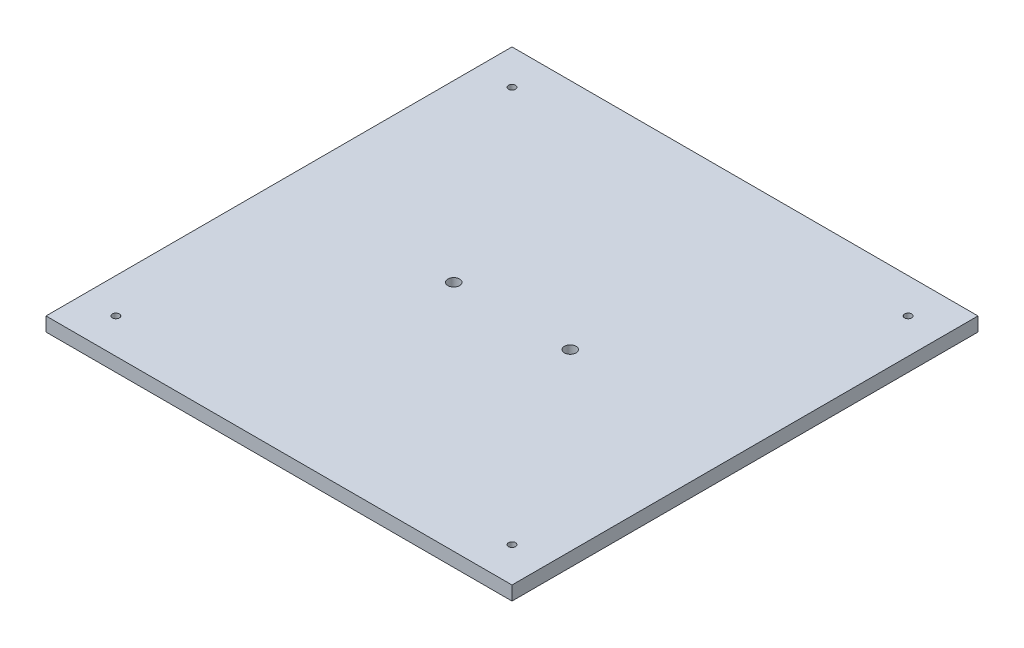
from build123d import *

# Parameters (mm, degrees)
SKETCH1_W           = 400
SKETCH1_H           = 400
SKETCH1_R           = 3
SKETCH1_R_2         = 5
BOSS_EXTRUDE1_DEPTH = 12


with BuildPart() as part:
    # Sketch1 → Boss-Extrude1 (new body)
    with BuildSketch(Plane(origin=(0, 0, 0), x_dir=(1, 0, 0), z_dir=(0, 1, 0))):
        Rectangle(SKETCH1_W, SKETCH1_H)
        with Locations(Location((-170, 170, 0), (0, 0, 270))):
            Circle(SKETCH1_R, mode=Mode.SUBTRACT)
        with Locations(Location((170, 170, 0), (0, 0, 270))):
            Circle(SKETCH1_R, mode=Mode.SUBTRACT)
        with Locations(Location((170, -170, 0), (0, 0, 270))):
            Circle(SKETCH1_R, mode=Mode.SUBTRACT)
        with Locations(Location((-170, -170, 0), (0, 0, 270))):
            Circle(SKETCH1_R, mode=Mode.SUBTRACT)
        with Locations(Location((-50, 0, 0), (0, 0, 270))):
            Circle(SKETCH1_R_2, mode=Mode.SUBTRACT)
        with Locations(Location((50, 0, 0), (0, 0, 270))):
            Circle(SKETCH1_R_2, mode=Mode.SUBTRACT)
    extrude(amount=BOSS_EXTRUDE1_DEPTH)


solid = part.part
